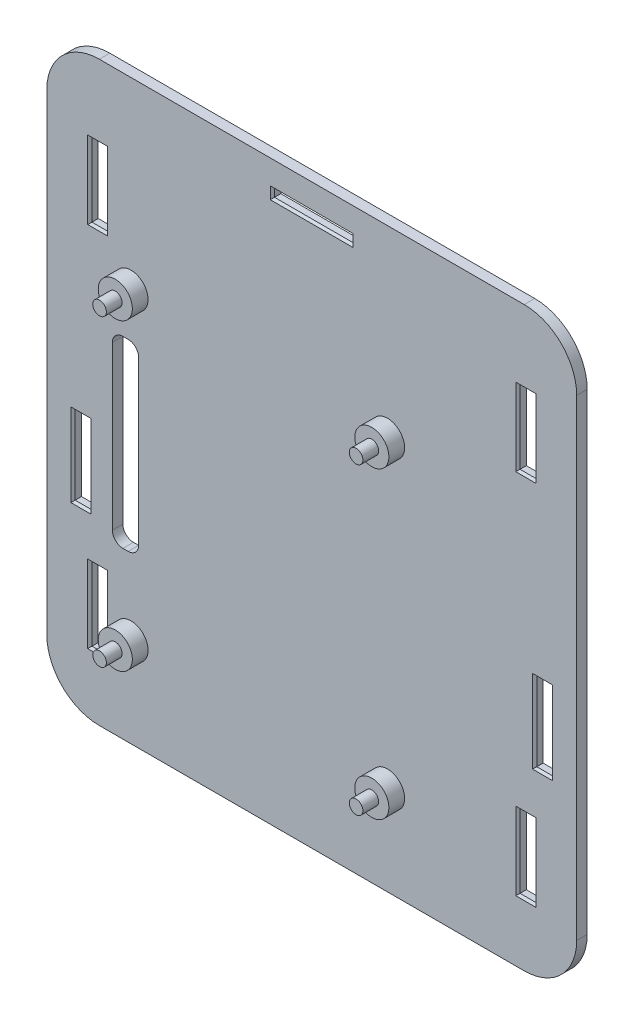
from build123d import *

# Parameters (mm, degrees)
SKETCH1_W           = 101
SKETCH1_H           = 110
BOSS_EXTRUDE1_DEPTH = 2
SKETCH3_W           = 15
SKETCH3_H           = 1.5
SKETCH3_W_2         = 3
SKETCH3_H_2         = 15
CUT_EXTRUDE1_DEPTH  = 128.433943673
SKETCH7_R           = 3.25
BOSS_EXTRUDE2_DEPTH = 3
SKETCH8_R           = 1.3
BOSS_EXTRUDE3_DEPTH = 3
CHAMFER2_SIZE       = 0.4
SKETCH9_W           = 3
SKETCH9_H           = 14
CUT_EXTRUDE2_DEPTH  = 5
CHAMFER3_SIZE       = 0.4
SKETCH10_W          = 5
SKETCH10_H          = 35
CUT_EXTRUDE3_DEPTH  = 128.559437126
FILLET1_R           = 2
FILLET2_R           = 10


with BuildPart() as part:
    # Sketch1 → Boss-Extrude1 (new body)
    with BuildSketch(Plane.XY):
        with Locations((42.5, 32.1)):
            Rectangle(SKETCH1_W, SKETCH1_H)
    extrude(amount=BOSS_EXTRUDE1_DEPTH)

    # Sketch3 → Cut-Extrude1 (cut, through all)
    with BuildSketch(Plane.XY.offset(2)):
        with Locations((42.5, 81.35)):
            Rectangle(SKETCH3_W, SKETCH3_H)
        with Locations((-1.5, 19.1)):
            Rectangle(SKETCH3_W_2, SKETCH3_H_2)
        with Locations((86.5, 19.1)):
            Rectangle(SKETCH3_W_2, SKETCH3_H_2)
    extrude(amount=-CUT_EXTRUDE1_DEPTH, mode=Mode.SUBTRACT)

    # Sketch7 → Boss-Extrude2 (add)
    with BuildSketch(Plane.XY.offset(2)):
        with Locations(Location((8.05, 52.05, 0), (0, 0, 180))):
            Circle(SKETCH7_R)
        with Locations(Location((56.95, 52.05, 0), (0, 0, 180))):
            Circle(SKETCH7_R)
        with Locations(Location((8.05, -5.85, 0), (0, 0, 180))):
            Circle(SKETCH7_R)
        with Locations(Location((56.95, -5.85, 0), (0, 0, 180))):
            Circle(SKETCH7_R)
    extrude(amount=BOSS_EXTRUDE2_DEPTH)

    # Sketch8 → Boss-Extrude3 (add)
    with BuildSketch(Plane.XY.offset(5)):
        with Locations(Location((8.05, -5.85, 0), (0, 0, 180))):
            Circle(SKETCH8_R)
        with Locations(Location((56.95, -5.85, 0), (0, 0, 180))):
            Circle(SKETCH8_R)
        with Locations(Location((56.95, 52.05, 0), (0, 0, 180))):
            Circle(SKETCH8_R)
        with Locations(Location((8.05, 52.05, 0), (0, 0, 180))):
            Circle(SKETCH8_R)
    extrude(amount=BOSS_EXTRUDE3_DEPTH)

    # Chamfer2
    chamfer2_edges = [part.edges().sort_by_distance(p)[0] for p in [
        (35, 81.35, 0),
        (42.5, 82.1, 0),
        (50, 81.35, 0),
        (42.5, 80.6, 0),
        (35, 81.35, 2),
        (42.5, 80.6, 2),
        (50, 81.35, 2),
        (42.5, 82.1, 2),
        (-3, 19.1, 0),
        (-1.5, 26.6, 0),
        (0, 19.1, 0),
        (-1.5, 11.6, 0),
        (-3, 19.1, 2),
        (-1.5, 11.6, 2),
        (0, 19.1, 2),
        (-1.5, 26.6, 2),
        (85, 19.1, 0),
        (86.5, 26.6, 0),
        (88, 19.1, 0),
        (86.5, 11.6, 0),
        (85, 19.1, 2),
        (86.5, 11.6, 2),
        (88, 19.1, 2),
        (86.5, 26.6, 2),
    ]]
    chamfer(chamfer2_edges, length=CHAMFER2_SIZE)

    # Sketch9 → Cut-Extrude2 (cut)
    with BuildSketch(Plane(origin=(0, 0, 0), x_dir=(-1, 0, 0), z_dir=(0, 0, -1))):
        with Locations((-83.3, -3.9)):
            Rectangle(SKETCH9_W, SKETCH9_H)
        with Locations((-83.3, 66.1)):
            Rectangle(SKETCH9_W, SKETCH9_H)
        with Locations((-1.7, -3.9)):
            Rectangle(SKETCH9_W, SKETCH9_H)
        with Locations((-1.7, 66.1)):
            Rectangle(SKETCH9_W, SKETCH9_H)
    extrude(amount=-CUT_EXTRUDE2_DEPTH, mode=Mode.SUBTRACT)

    # Chamfer3
    chamfer3_edges = [part.edges().sort_by_distance(p)[0] for p in [
        (84.8, -3.9, 2),
        (83.3, 3.1, 2),
        (81.8, -3.9, 2),
        (83.3, -10.9, 2),
        (84.8, -3.9, 0),
        (83.3, -10.9, 0),
        (81.8, -3.9, 0),
        (83.3, 3.1, 0),
        (84.8, 66.1, 2),
        (83.3, 73.1, 2),
        (81.8, 66.1, 2),
        (83.3, 59.1, 2),
        (84.8, 66.1, 0),
        (83.3, 59.1, 0),
        (81.8, 66.1, 0),
        (83.3, 73.1, 0),
        (3.2, -3.9, 2),
        (1.7, 3.1, 2),
        (0.2, -3.9, 2),
        (1.7, -10.9, 2),
        (3.2, -3.9, 0),
        (1.7, -10.9, 0),
        (0.2, -3.9, 0),
        (1.7, 3.1, 0),
        (3.2, 66.1, 2),
        (1.7, 73.1, 2),
        (0.2, 66.1, 2),
        (1.7, 59.1, 2),
        (3.2, 66.1, 0),
        (1.7, 59.1, 0),
        (0.2, 66.1, 0),
        (1.7, 73.1, 0),
    ]]
    chamfer(chamfer3_edges, length=CHAMFER3_SIZE)

    # Sketch10 → Cut-Extrude3 (cut, through all)
    with BuildSketch(Plane.XY.offset(2)):
        with Locations((7, 26.1)):
            Rectangle(SKETCH10_W, SKETCH10_H)
    extrude(amount=-CUT_EXTRUDE3_DEPTH, mode=Mode.SUBTRACT)

    # Fillet1
    fillet1_edges = [part.edges().sort_by_distance(p)[0] for p in [
        (4.5, 8.6, 1),
        (4.5, 43.6, 1),
        (9.5, 43.6, 1),
        (9.5, 8.6, 1),
    ]]
    fillet(fillet1_edges, radius=FILLET1_R)

    # Fillet2
    fillet2_edges = [part.edges().sort_by_distance(p)[0] for p in [
        (-8, 87.1, 1),
        (93, 87.1, 1),
        (93, -22.9, 1),
        (-8, -22.9, 1),
    ]]
    fillet(fillet2_edges, radius=FILLET2_R)


solid = part.part
